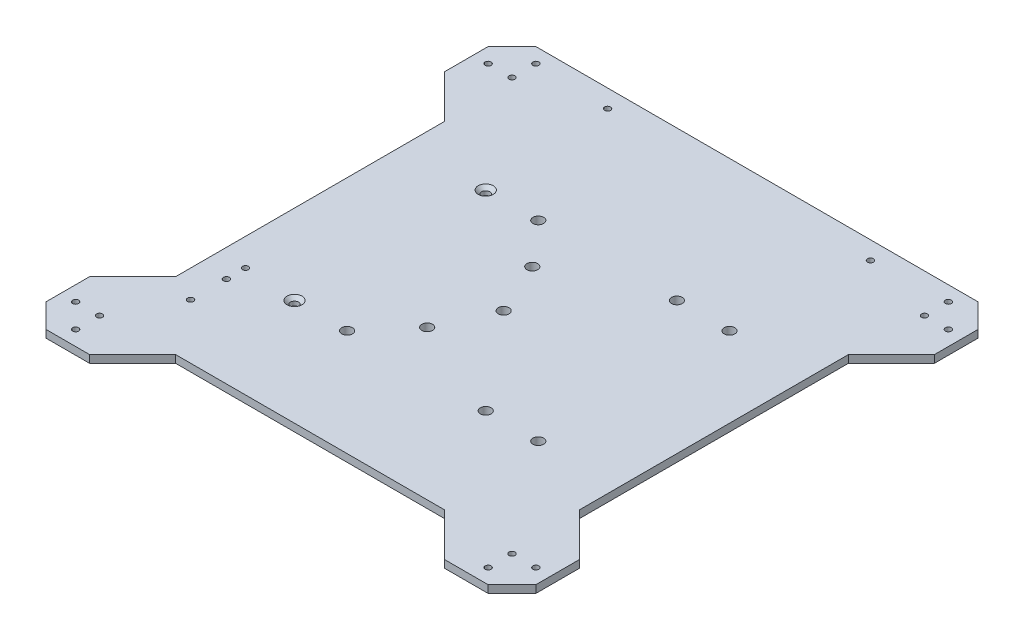
from build123d import *

# Parameters (mm, degrees)
BOSS_EXTRUDE1_DEPTH                             = 3.175
SKETCH2_R                                       = 1.5
SKETCH2_R_2                                     = 2.25
CUT_EXTRUDE1_DEPTH                              = 145.991657088
M3X0_5_TAPPED_HOLE1_D                           = 2.5
SKETCH5_R                                       = 1.25
CUT_EXTRUDE2_DEPTH                              = 145.991657088
SKETCH6_R                                       = 1.25
CUT_EXTRUDE3_DEPTH                              = 10
CSK_FOR_M3_FLAT_HEAD_MACHINE_SCREW1_D           = 3.4
CSK_FOR_M3_FLAT_HEAD_MACHINE_SCREW1_CSINK_D     = 6.3
CSK_FOR_M3_FLAT_HEAD_MACHINE_SCREW1_CSINK_ANGLE = 90
CUT_EXTRUDE4_DEPTH                              = 10


with BuildPart() as part:
    # Sketch1 → Boss-Extrude1 (new body)
    with BuildSketch(Plane(origin=(0, 0, 0), x_dir=(1, 0, 0), z_dir=(0, 1, 0))):
        Polygon((-92.5, 102.5), (92.5, 102.5), (102.5, 92.5), (102.5, -92.5), (92.5, -102.5), (-92.5, -102.5), (-102.5, -92.5), (-102.5, 92.5), align=None)
    extrude(amount=BOSS_EXTRUDE1_DEPTH)

    # Sketch2 → Cut-Extrude1 (cut, through all)
    with BuildSketch(Plane(origin=(0, 3.175, 0), x_dir=(1, 0, 0), z_dir=(0, 1, 0))):
        with Locations(Location((-51, -40, 0), (0, 0, 270))):
            Circle(SKETCH2_R)
        with Locations(Location((-29, -40, 0), (0, 0, 270))):
            Circle(SKETCH2_R_2)
        with Locations(Location((-51, 40, 0), (0, 0, 270))):
            Circle(SKETCH2_R)
        with Locations(Location((-29, 40, 0), (0, 0, 270))):
            Circle(SKETCH2_R_2)
        with Locations(Location((29, 40, 0), (0, 0, 270))):
            Circle(SKETCH2_R_2)
        with Locations(Location((51, 40, 0), (0, 0, 270))):
            Circle(SKETCH2_R_2)
        with Locations(Location((29, -40, 0), (0, 0, 270))):
            Circle(SKETCH2_R_2)
        with Locations(Location((51, -40, 0), (0, 0, 270))):
            Circle(SKETCH2_R_2)
        with Locations(Location((-3.5, 0, 0), (0, 0, 270))):
            Circle(SKETCH2_R_2)
        with Locations(Location((-13.5, 22, 0), (0, 0, 270))):
            Circle(SKETCH2_R_2)
        with Locations(Location((-13.5, -22, 0), (0, 0, 270))):
            Circle(SKETCH2_R_2)
    extrude(amount=-CUT_EXTRUDE1_DEPTH, mode=Mode.SUBTRACT)

    # M3x0.5 Tapped Hole1 (through all)
    with Locations(Plane(origin=(0, 3.175, 0), x_dir=(-1, 0, 0), z_dir=(0, 1, 0))):
        with Locations((96.3, -86.3), (86.3, -96.3), (-86.3, -96.3), (-96.3, -86.3), (-96.3, 86.3), (-86.3, 96.3), (86.3, 96.3), (96.3, 86.3), (-86.3, 86.3), (-86.3, -86.3), (86.3, -86.3), (86.3, 86.3)):
            Hole(M3X0_5_TAPPED_HOLE1_D / 2)

    # Sketch5 → Cut-Extrude2 (cut, through all)
    with BuildSketch(Plane(origin=(0, 3.175, 0), x_dir=(1, 0, 0), z_dir=(0, 1, 0))):
        with Locations(Location((-55, 95, 0), (0, 0, 270))):
            Circle(SKETCH5_R)
        with Locations(Location((55, 95, 0), (0, 0, 270))):
            Circle(SKETCH5_R)
        with Locations(Location((-55, -95, 0), (0, 0, 270))):
            Circle(SKETCH5_R)
        with Locations(Location((55, -95, 0), (0, 0, 270))):
            Circle(SKETCH5_R)
    extrude(amount=-CUT_EXTRUDE2_DEPTH, mode=Mode.SUBTRACT)

    # Sketch6 → Cut-Extrude3 (cut)
    with BuildSketch(Plane(origin=(0, 3.175, 0), x_dir=(1, 0, 0), z_dir=(0, 1, 0))):
        with Locations(Location((-73, -46.5, 0), (0, 0, 270))):
            Circle(SKETCH6_R)
        with Locations(Location((-73, -38.5, 0), (0, 0, 270))):
            Circle(SKETCH6_R)
        with Locations(Location((-73, -61.5, 0), (0, 0, 270))):
            Circle(SKETCH6_R)
    extrude(amount=-CUT_EXTRUDE3_DEPTH, mode=Mode.SUBTRACT)

    # CSK for M3 Flat Head Machine Screw1 (through all)
    with Locations(Plane(origin=(0, 3.175, 0), x_dir=(-1, 0, 0), z_dir=(0, 1, 0))):
        with Locations((51, -40), (51, 40)):
            CounterSinkHole(CSK_FOR_M3_FLAT_HEAD_MACHINE_SCREW1_D / 2, CSK_FOR_M3_FLAT_HEAD_MACHINE_SCREW1_CSINK_D / 2, counter_sink_angle=CSK_FOR_M3_FLAT_HEAD_MACHINE_SCREW1_CSINK_ANGLE)

    # Sketch9 → Cut-Extrude4 (cut)
    with BuildSketch(Plane(origin=(0, 3.175, 0), x_dir=(1, 0, 0), z_dir=(0, 1, 0))):
        Polygon((-102.5, 74.215728753), (-84.5, 56.215728753), (-84.5, -56.215728753), (-102.5, -74.215728753), align=None)
        Polygon((102.5, 74.215728753), (84.5, 56.215728753), (84.5, -56.215728753), (102.5, -74.215728753), align=None)
        Polygon((-74.215728753, -102.5), (-56.215728753, -84.5), (56.215728753, -84.5), (74.215728753, -102.5), align=None)
    extrude(amount=-CUT_EXTRUDE4_DEPTH, mode=Mode.SUBTRACT)


solid = part.part
